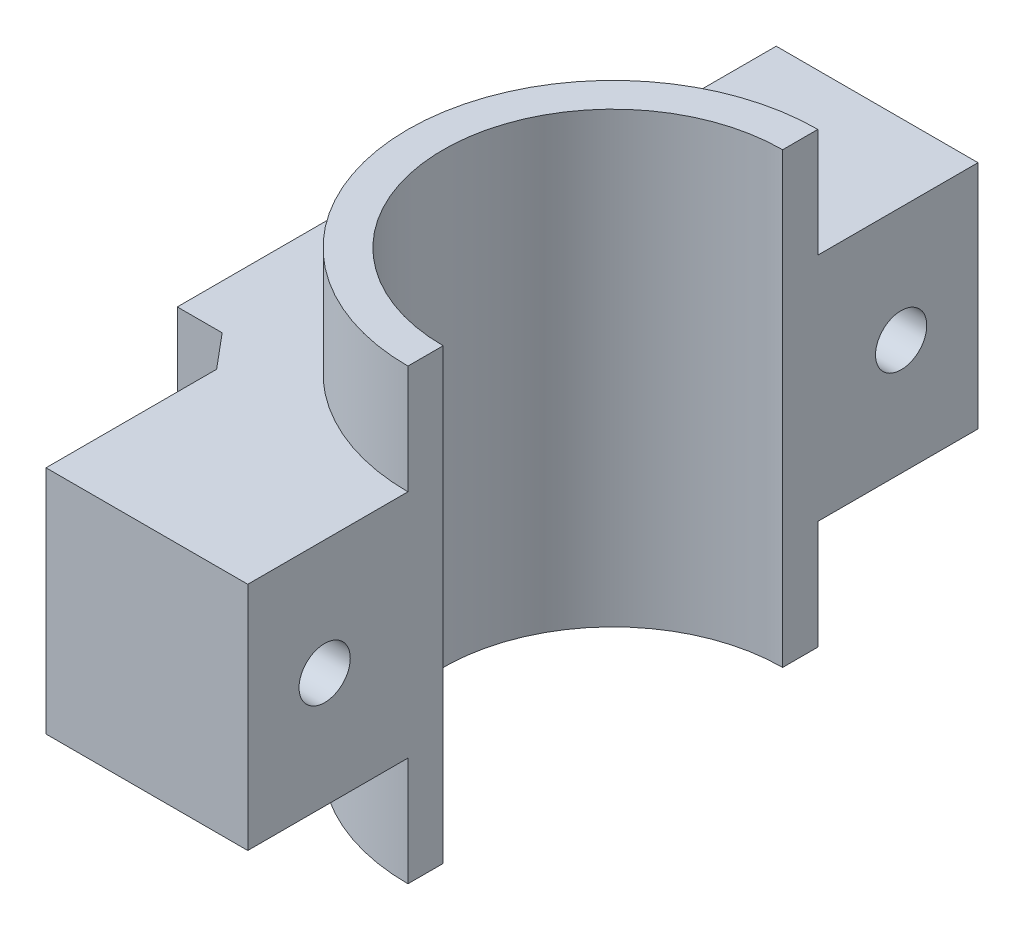
from build123d import *

# Parameters (mm, degrees)
BOSS_EXTRUDE1_DEPTH = 18
BOSS_EXTRUDE2_DEPTH = 35
CUT_EXTRUDE1_REACH  = 81.517
SKETCH2_R           = 4


with BuildPart() as part:
    # Sketch1 → Boss-Extrude1 (new, symmetric)
    with BuildSketch(Plane(origin=(0, 0, 0), x_dir=(1, 0, 0), z_dir=(0, 1, 0))):
        with BuildLine():
            ThreePointArc((0, -32), (-32, 0), (0, 32))
            Line((0, 32), (0, 57))
            Line((0, 57), (-31.500486732, 57))
            Line((-31.500486732, 57), (-31.500486732, 30.362311102))
            Line((-31.500486732, 30.362311102), (-36, 25))
            Line((-36, 25), (-43, 25))
            Line((-43, 25), (-43, -25))
            Line((-43, -25), (-36, -25))
            Line((-36, -25), (-31.500486732, -30.362311102))
            Line((-31.500486732, -30.362311102), (-31.500486732, -57))
            Line((-31.500486732, -57), (0, -57))
            Line((0, -57), (0, -32))
        make_face()
    extrude(amount=BOSS_EXTRUDE1_DEPTH, both=True)

    # Sketch1<3> → Boss-Extrude2 (add, symmetric)
    with BuildSketch(Plane(origin=(0, 0, 0), x_dir=(1, 0, 0), z_dir=(0, 1, 0))):
        with BuildLine():
            ThreePointArc((0, -26.5), (-26.5, 0), (0, 26.5))
            Line((0, 26.5), (0, 32))
            ThreePointArc((0, 32), (-32, 0), (0, -32))
            Line((0, -32), (0, -26.5))
        make_face()
    extrude(amount=BOSS_EXTRUDE2_DEPTH, both=True)

    # Sketch2 → Cut-Extrude1 (cut, up to next)
    with BuildSketch(Plane(origin=(0, 0, 0), x_dir=(0, 0, -1), z_dir=(1, 0, 0)), mode=Mode.PRIVATE) as cut_extrude1_sk1:
        with Locations((-45, 0)):
            Circle(SKETCH2_R)
    cut_extrude1_tool1 = extrude(cut_extrude1_sk1.sketch, amount=-CUT_EXTRUDE1_REACH, mode=Mode.PRIVATE) & part.part
    cut_extrude1 = cut_extrude1_tool1.solids().sort_by_distance((0, 0, 45))[0]
    add(cut_extrude1, mode=Mode.SUBTRACT)

    # Mirror1: Cut-Extrude1 across plane
    add(cut_extrude1.mirror(Plane.XY), mode=Mode.SUBTRACT)


solid = part.part
